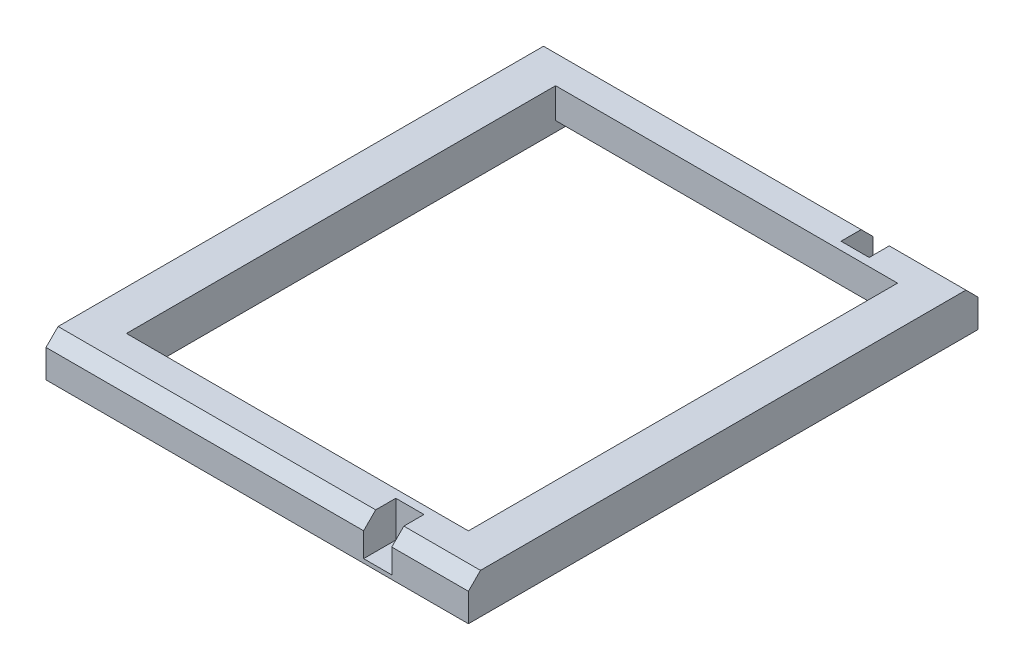
from build123d import *

# Parameters (mm, degrees)
SKETCH2_W           = 133.35
SKETCH2_H           = 160.866666666
SKETCH2_W_2         = 107.95
SKETCH2_H_2         = 135.466666666
BOSS_EXTRUDE1_DEPTH = 12.7
CUT_EXTRUDE1_DEPTH  = 6.35
CHAMFER4_SIZE       = 3.81
CHAMFER1_SIZE       = 0.635
CHAMFER2_SIZE       = 3.175
SKETCH4_W           = 8.89
SKETCH4_H           = 11.43
CUT_EXTRUDE2_DEPTH  = 10.16
SKETCH5_W           = 8.89
SKETCH5_H           = 11.43
CUT_EXTRUDE3_DEPTH  = 10.16


with BuildPart() as part:
    # Sketch2 → Boss-Extrude1 (new body)
    with BuildSketch(Plane(origin=(0, 0, 0), x_dir=(1, 0, 0), z_dir=(0, 1, 0))):
        Rectangle(SKETCH2_W, SKETCH2_H)
        Rectangle(SKETCH2_W_2, SKETCH2_H_2, mode=Mode.SUBTRACT)
    extrude(amount=BOSS_EXTRUDE1_DEPTH)

    # Sketch3 → Cut-Extrude1 (cut)
    with BuildSketch(Plane.XZ):
        Polygon((-57.15, 76.2), (-60.325, 73.025), (-63.5, 76.2), (-60.325, 79.375), align=None)
        Polygon((57.15, 76.2), (53.975, 73.025), (50.8, 76.2), (53.975, 79.375), align=None)
        Polygon((57.15, -76.2), (53.975, -79.375), (50.8, -76.2), (53.975, -73.025), align=None)
        Polygon((-57.15, -76.2), (-60.325, -79.375), (-63.5, -76.2), (-60.325, -73.025), align=None)
    extrude(amount=-CUT_EXTRUDE1_DEPTH, mode=Mode.SUBTRACT)

    # Chamfer4
    chamfer4_edges = [part.edges().sort_by_distance(p)[0] for p in [
        (0, 12.7, -80.433333333),
        (0, 12.7, 80.433333333),
    ]]
    chamfer(chamfer4_edges, length=CHAMFER4_SIZE)

    # Chamfer1
    chamfer1_edges = [part.edges().sort_by_distance(p)[0] for p in [
        (-58.7375, 6.35, -74.6125),
        (-58.7375, 6.35, -77.7875),
        (-61.9125, 6.35, -77.7875),
        (-61.9125, 6.35, -74.6125),
        (-58.7375, 0, -74.6125),
        (-61.9125, 0, -74.6125),
        (-61.9125, 0, -77.7875),
        (-58.7375, 0, -77.7875),
        (55.5625, 6.35, -74.6125),
        (55.5625, 6.35, -77.7875),
        (52.3875, 6.35, -77.7875),
        (52.3875, 6.35, -74.6125),
        (55.5625, 0, -74.6125),
        (52.3875, 0, -74.6125),
        (52.3875, 0, -77.7875),
        (55.5625, 0, -77.7875),
        (55.5625, 6.35, 77.7875),
        (55.5625, 6.35, 74.6125),
        (52.3875, 6.35, 74.6125),
        (52.3875, 6.35, 77.7875),
        (55.5625, 0, 77.7875),
        (52.3875, 0, 77.7875),
        (52.3875, 0, 74.6125),
        (55.5625, 0, 74.6125),
        (-58.7375, 6.35, 77.7875),
        (-58.7375, 6.35, 74.6125),
        (-61.9125, 6.35, 74.6125),
        (-61.9125, 6.35, 77.7875),
        (-58.7375, 0, 77.7875),
        (-61.9125, 0, 77.7875),
        (-61.9125, 0, 74.6125),
        (-58.7375, 0, 74.6125),
    ]]
    chamfer(chamfer1_edges, length=CHAMFER1_SIZE)

    # Chamfer2
    chamfer2_edges = [part.edges().sort_by_distance(p)[0] for p in [
        (53.975, 0, 0),
        (0, 0, -67.733333333),
        (0, 0, 67.733333333),
    ]]
    chamfer(chamfer2_edges, length=CHAMFER2_SIZE)

    # Sketch4 → Cut-Extrude2 (cut)
    with BuildSketch(Plane.XY.offset(80.433333333)):
        with Locations((38.0365, 6.985)):
            Rectangle(SKETCH4_W, SKETCH4_H)
    extrude(amount=-CUT_EXTRUDE2_DEPTH, mode=Mode.SUBTRACT)

    # Sketch5 → Cut-Extrude3 (cut)
    with BuildSketch(Plane(origin=(0, 0, -80.433333333), x_dir=(-1, 0, 0), z_dir=(0, 0, -1))):
        with Locations((-38.0365, 6.985)):
            Rectangle(SKETCH5_W, SKETCH5_H)
    extrude(amount=-CUT_EXTRUDE3_DEPTH, mode=Mode.SUBTRACT)


solid = part.part
